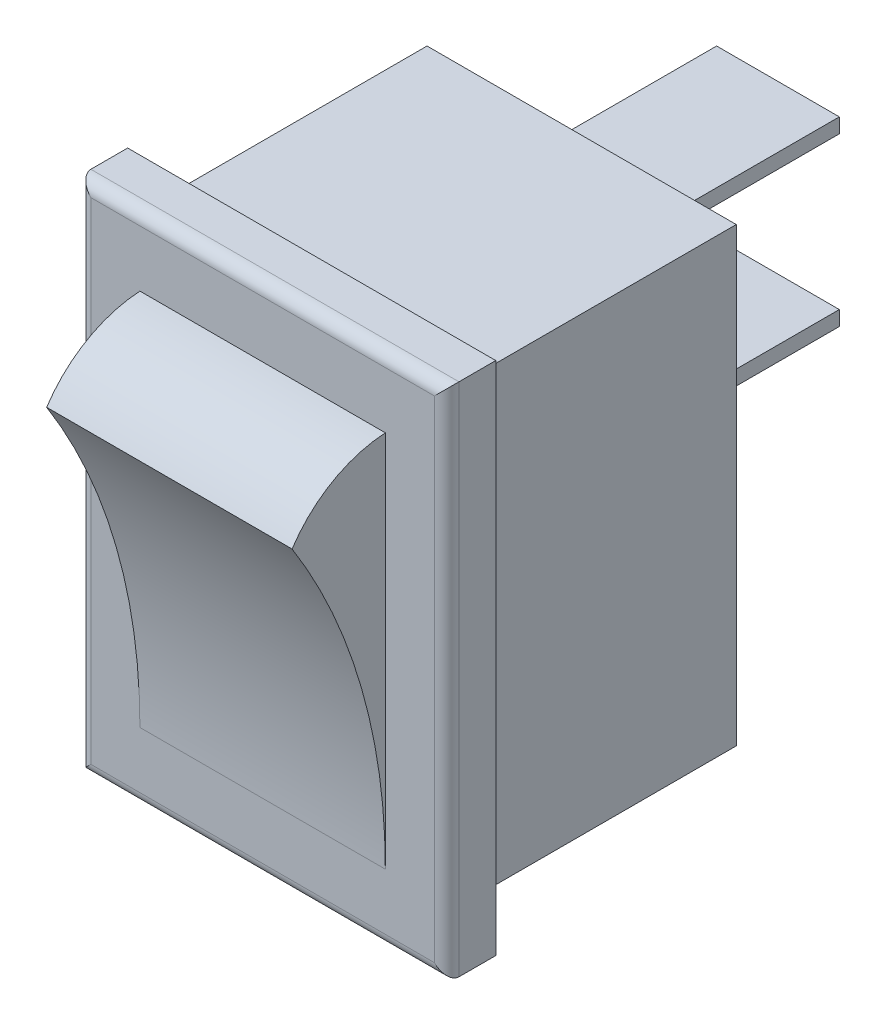
from build123d import *

# Parameters (mm, degrees)
SKETCH_1_W             = 12.6
SKETCH_1_H             = 18.4
EXTRUDE_1_DEPTH        = 11
SKETCH_2_W             = 15
SKETCH_2_H             = 21
EXTRUDE_2_DEPTH        = 2
FILLET_1_R             = 0.5
EXTRUDE_3_DEPTH        = 5
SKETCH_4_W             = 5
SKETCH_4_H             = 0.6
EXTRUDE_4_DEPTH        = 8
PATTERN_LINEAR_1_COUNT = 2
PATTERN_LINEAR_1_PITCH = 6.8


with BuildPart() as part:
    # Эскиз1 → Бобышка-Вытянуть1 (new body)
    with BuildSketch(Plane.XY):
        Rectangle(SKETCH_1_W, SKETCH_1_H)
    extrude(amount=EXTRUDE_1_DEPTH)

    # Эскиз2 → Бобышка-Вытянуть2 (add)
    with BuildSketch(Plane.XY.offset(11)):
        Rectangle(SKETCH_2_W, SKETCH_2_H)
    extrude(amount=EXTRUDE_2_DEPTH)

    # Скругление1
    fillet_1_edges = [part.edges().sort_by_distance(p)[0] for p in [
        (7.5, 0, 13),
        (0, 10.5, 13),
        (-7.5, 0, 13),
        (0, -10.5, 13),
    ]]
    fillet(fillet_1_edges, radius=FILLET_1_R)

    # Эскиз3 → Бобышка-Вытянуть3 (add, symmetric)
    with BuildSketch(Plane(origin=(0, 0, 0), x_dir=(0, 0, -1), z_dir=(1, 0, 0))):
        with BuildLine():
            Line((-13, -7.7), (-13, 7.7))
            ThreePointArc((-13, 7.7), (-15.160810119, 7.050490206), (-16.8, 5.5))
            ThreePointArc((-16.8, 5.5), (-13.968906968, -0.831958067), (-13, -7.7))
        make_face()
    extrude(amount=EXTRUDE_3_DEPTH, both=True)

    # Эскиз4 → Бобышка-Вытянуть4 (add)
    with BuildSketch(Plane(origin=(0, 0, 0), x_dir=(-1, 0, 0), z_dir=(0, 0, -1))):
        Rectangle(SKETCH_4_W, SKETCH_4_H)
    extrude_4 = extrude(amount=EXTRUDE_4_DEPTH)

    # Линейный массив1: Бобышка-Вытянуть4 ×2
    with Locations(*[(0, i * PATTERN_LINEAR_1_PITCH, 0) for i in range(1, PATTERN_LINEAR_1_COUNT)]):
        add(extrude_4)


solid = part.part
